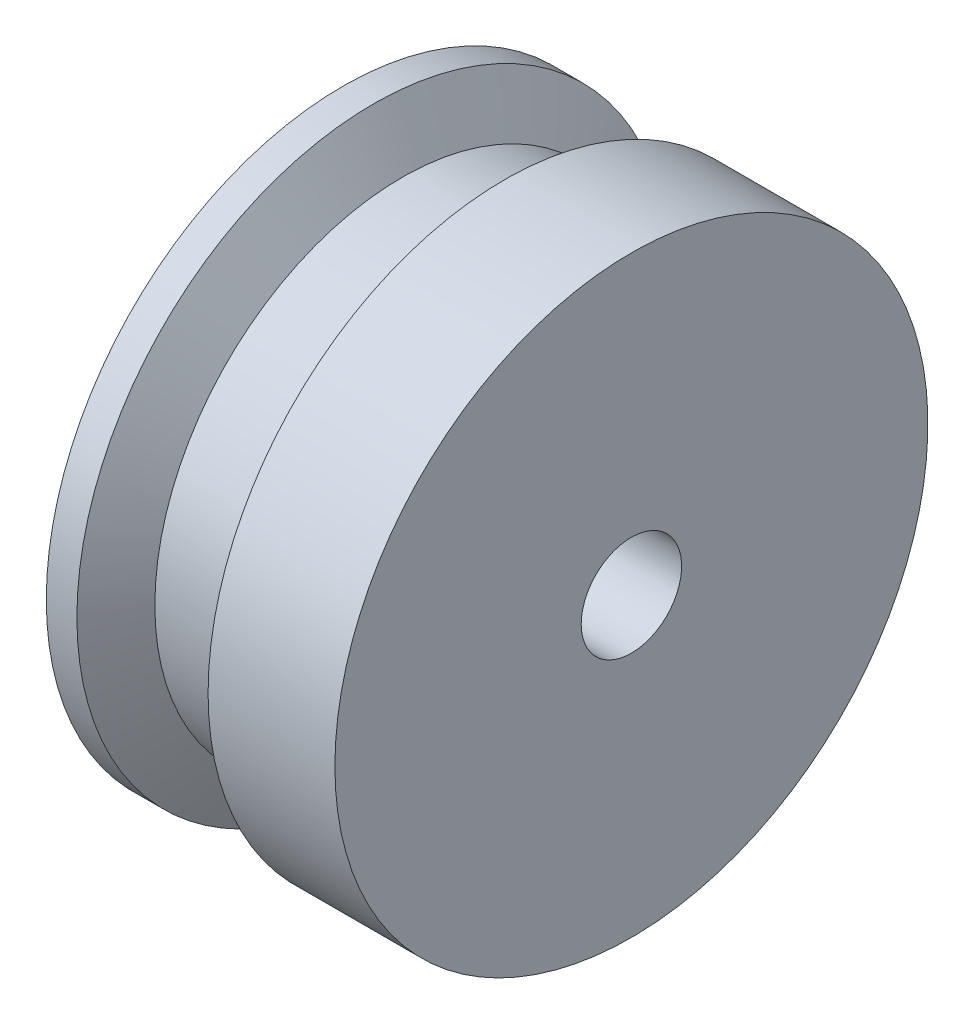
from build123d import *


with BuildPart() as part:
    # Sketch1 → Revolve1 (revolve)
    with BuildSketch(Plane.XY, mode=Mode.PRIVATE) as revolve1_sk:
        Polygon((0, 3.2258), (18.542, 3.2258), (18.542, 19.05), (10.395003771, 19.05), (8.561916667, 15.875), (3.799416667, 15.875), (1.966329562, 19.05), (0, 19.05), align=None)
    revolve(revolve1_sk.sketch.rotate(Axis((0, 0, 0), (1, 0, 0)), 90), axis=Axis((0, 0, 0), (1, 0, 0)))


solid = part.part
